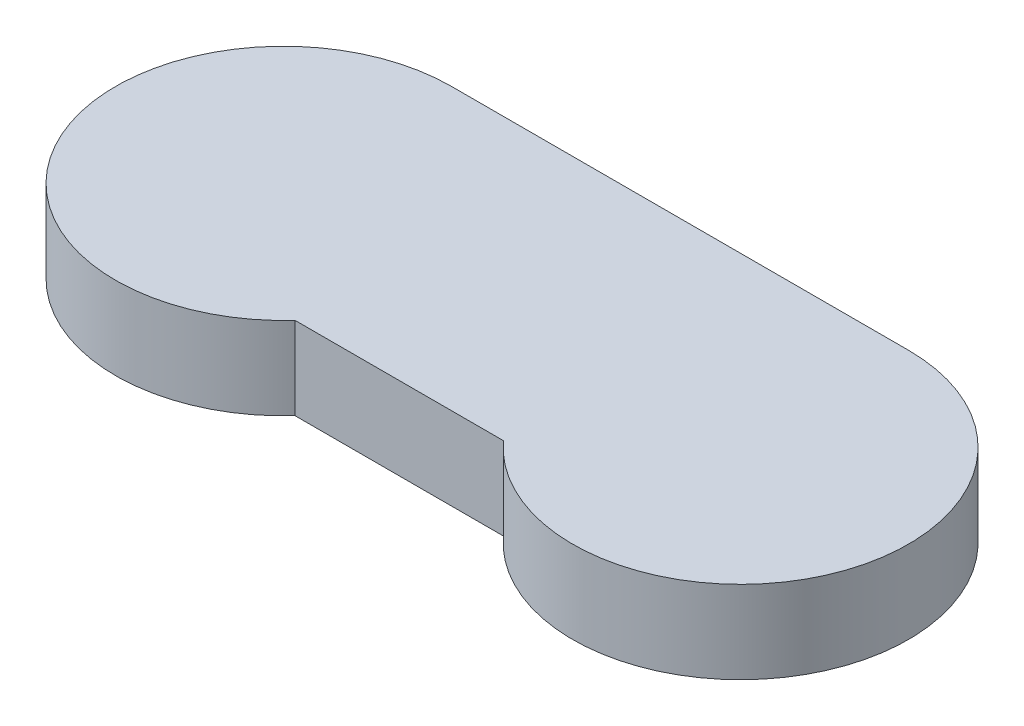
from build123d import *

# Parameters (mm, degrees)
BOSS_EXTRUDE1_DEPTH = 15
CUT_EXTRUDE1_DEPTH  = 10


with BuildPart() as part:
    # Sketch1 → Boss-Extrude1 (new body)
    with BuildSketch(Plane(origin=(0, 0, 0), x_dir=(1, 0, 0), z_dir=(0, 1, 0))):
        with BuildLine():
            Line((41.5, 30.5), (-41.5, 30.5))
            ThreePointArc((-41.5, 30.5), (-69.388169535, -12.349089035), (-18.916820419, -20.5))
            Line((-18.916820419, -20.5), (18.916820419, -20.5))
            ThreePointArc((18.916820419, -20.5), (69.388169535, -12.349089035), (41.5, 30.5))
        make_face()
    extrude(amount=BOSS_EXTRUDE1_DEPTH)

    # Sketch2 → Cut-Extrude1 (cut)
    with BuildSketch(Plane(origin=(0, 0, 0), x_dir=(1, 0, 0), z_dir=(0, 1, 0))):
        with BuildLine():
            Line((41.5, 25.5), (-41.5, 25.5))
            ThreePointArc((-41.5, 25.5), (-64.36372673, -11.291589791), (-21.251543269, -15.5))
            Line((-21.251543269, -15.5), (21.251543269, -15.5))
            ThreePointArc((21.251543269, -15.5), (64.36372673, -11.291589791), (41.5, 25.5))
        make_face()
    extrude(amount=CUT_EXTRUDE1_DEPTH, mode=Mode.SUBTRACT)


solid = part.part
